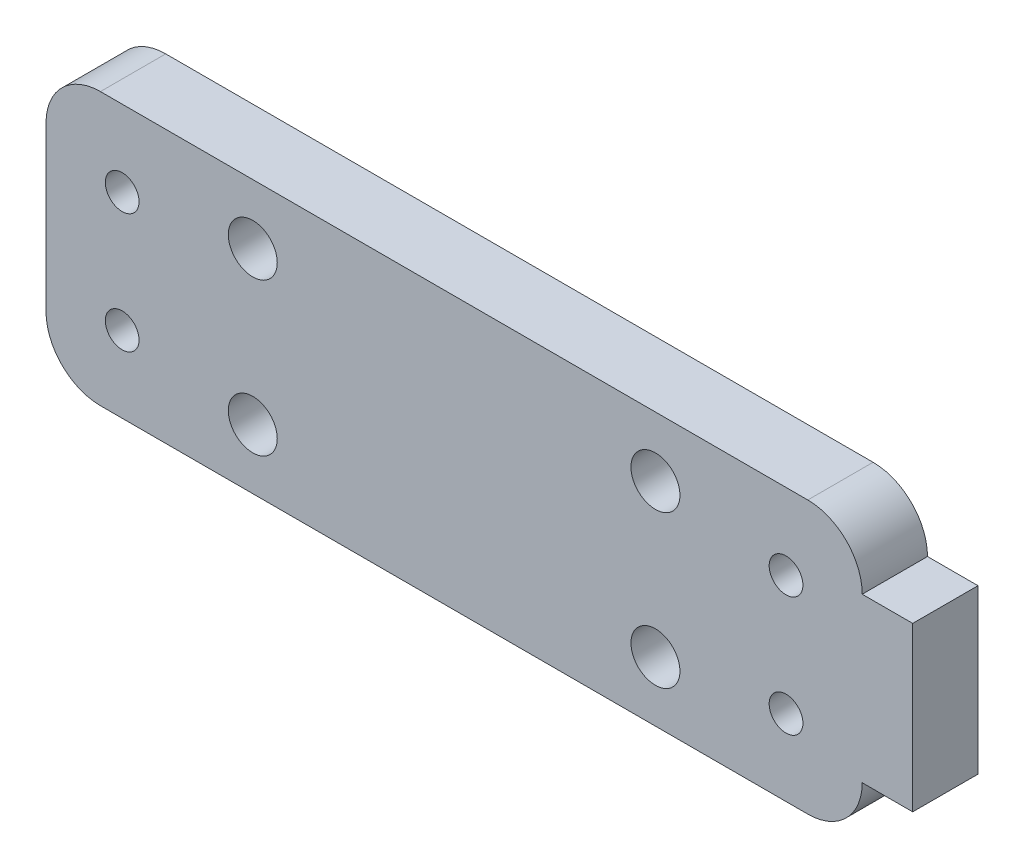
from build123d import *

# Parameters (mm, degrees)
SKETCH1_R           = 1.55
SKETCH1_R_2         = 2.25
BOSS_EXTRUDE1_DEPTH = 6
SKETCH4_W           = 6
SKETCH4_H           = 15
BOSS_EXTRUDE3_DEPTH = 4.64


with BuildPart() as part:
    # Sketch1 → Boss-Extrude1 (new body)
    with BuildSketch(Plane.XY):
        with BuildLine():
            Line((5, 0), (70, 0))
            ThreePointArc((70, 0), (73.535533906, -1.464466094), (75, -5))
            Line((75, -5), (75, -20))
            ThreePointArc((75, -20), (73.535533906, -23.535533906), (70, -25))
            Line((70, -25), (5, -25))
            ThreePointArc((5, -25), (1.464466094, -23.535533906), (0, -20))
            Line((0, -20), (0, -5))
            ThreePointArc((0, -5), (1.464466094, -1.464466094), (5, 0))
        make_face()
        with Locations((7, -7)):
            Circle(SKETCH1_R, mode=Mode.SUBTRACT)
        with Locations((7, -18)):
            Circle(SKETCH1_R, mode=Mode.SUBTRACT)
        with Locations((68, -7)):
            Circle(SKETCH1_R, mode=Mode.SUBTRACT)
        with Locations((68, -18)):
            Circle(SKETCH1_R, mode=Mode.SUBTRACT)
        with Locations((19, -5.5)):
            Circle(SKETCH1_R_2, mode=Mode.SUBTRACT)
        with Locations((19, -19.5)):
            Circle(SKETCH1_R_2, mode=Mode.SUBTRACT)
        with Locations((56, -5.5)):
            Circle(SKETCH1_R_2, mode=Mode.SUBTRACT)
        with Locations((56, -19.5)):
            Circle(SKETCH1_R_2, mode=Mode.SUBTRACT)
    extrude(amount=BOSS_EXTRUDE1_DEPTH)

    # Sketch4 → Boss-Extrude3 (add)
    with BuildSketch(Plane(origin=(75, 0, 0), x_dir=(0, 0, -1), z_dir=(1, 0, 0))):
        with Locations((-3, -12.5)):
            Rectangle(SKETCH4_W, SKETCH4_H)
    extrude(amount=BOSS_EXTRUDE3_DEPTH)


solid = part.part
